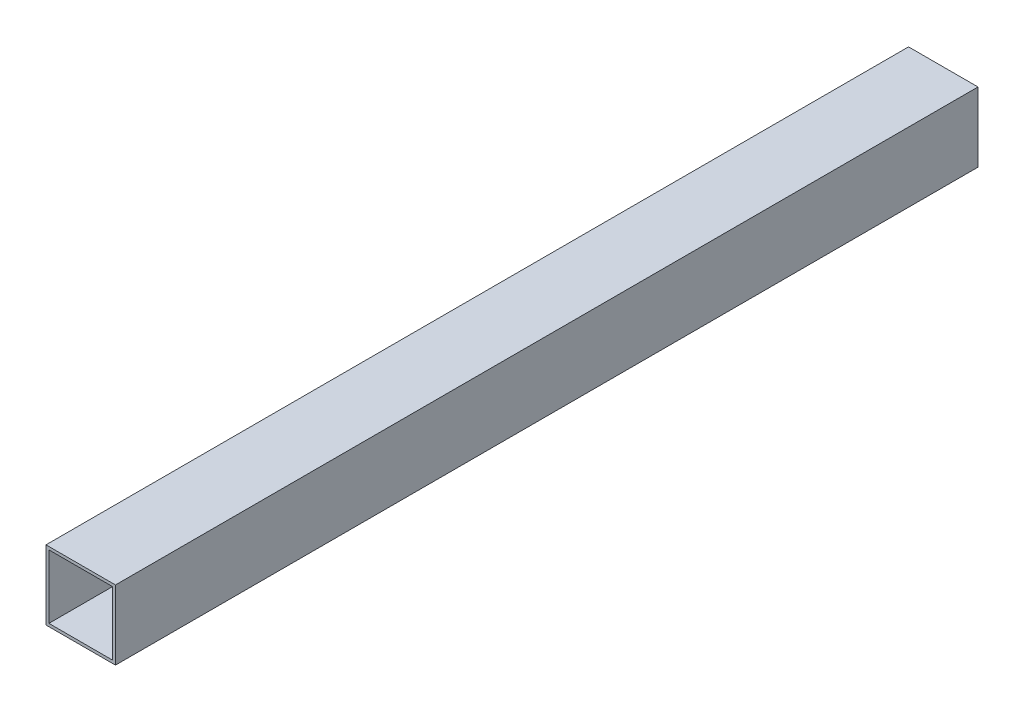
from build123d import *

# Parameters (mm, degrees)
SKETCH2_W           = 76.2
SKETCH2_H           = 76.2
BOSS_EXTRUDE1_DEPTH = 946.15
SKETCH3_W           = 69.85
SKETCH3_H           = 69.85
CUT_EXTRUDE1_DEPTH  = 1098.55


with BuildPart() as part:
    # Sketch2 → Boss-Extrude1 (new body)
    with BuildSketch(Plane.XY):
        with Locations((-2.629709588, -19.469024582)):
            Rectangle(SKETCH2_W, SKETCH2_H)
    extrude(amount=BOSS_EXTRUDE1_DEPTH)

    # Sketch3 → Cut-Extrude1 (cut)
    with BuildSketch(Plane.XY.offset(946.15)):
        with Locations((-2.629709588, -19.469024582)):
            Rectangle(SKETCH3_W, SKETCH3_H)
    extrude(amount=-CUT_EXTRUDE1_DEPTH, mode=Mode.SUBTRACT)


solid = part.part
